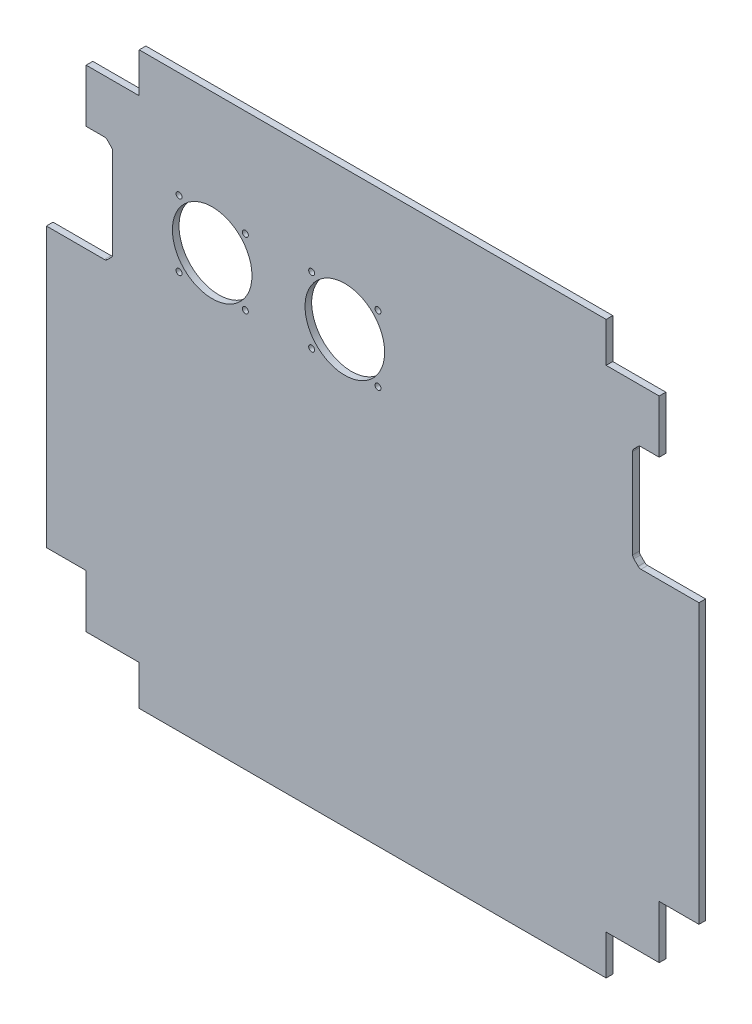
from build123d import *

# Parameters (mm, degrees)
SALIENTE_EXTRUIR1_DEPTH = 5
CROQUIS3_W              = 50
CROQUIS3_H              = 80
CORTAR_EXTRUIR2_DEPTH   = 10
CHAFL_N1_SIZE           = 5
REDONDEO1_R             = 3
CROQUIS4_R              = 2.25
CORTAR_EXTRUIR3_DEPTH   = 5
CROQUIS5_R              = 30
CORTAR_EXTRUIR4_DEPTH   = 327.750669471


with BuildPart() as part:
    # Croquis1 → Saliente-Extruir1 (new body)
    with BuildSketch(Plane.XY):
        Polygon((0, 215), (0, 0), (246, 0), (246, 145), (216, 145), (216, 185), (176, 185), (176, 215), align=None)
        Polygon((-246, 145), (-246, 0), (0, 0), (0, 215), (-176, 215), (-176, 185), (-216, 185), (-216, 145), align=None)
        Polygon((0, 0), (-246, 0), (-246, -145), (-216, -145), (-216, -185), (-176, -185), (-176, -215), (176, -215), (176, -185), (216, -185), (216, -145), (246, -145), (246, 0), align=None)
    extrude(amount=SALIENTE_EXTRUIR1_DEPTH)

    # Croquis3 → Cortar-Extruir2 (cut)
    with BuildSketch(Plane.XY.offset(5)):
        with Locations((-221, 105)):
            Rectangle(CROQUIS3_W, CROQUIS3_H)
        with Locations((221, 105)):
            Rectangle(CROQUIS3_W, CROQUIS3_H)
    extrude(amount=-CORTAR_EXTRUIR2_DEPTH, mode=Mode.SUBTRACT)

    # Chaflán1
    chafl_n1_edges = [part.edges().sort_by_distance(p)[0] for p in [
        (-196, 65, 2.5),
        (-196, 145, 2.5),
        (196, 65, 2.5),
        (196, 145, 2.5),
    ]]
    chamfer(chafl_n1_edges, length=CHAFL_N1_SIZE)

    # Redondeo1
    redondeo1_edges = [part.edges().sort_by_distance(p)[0] for p in [
        (-196, 140, 2.5),
        (-196, 70, 2.5),
        (-201, 65, 2.5),
        (-201, 145, 2.5),
        (201, 65, 2.5),
        (196, 140, 2.5),
        (196, 70, 2.5),
        (201, 145, 2.5),
    ]]
    fillet(redondeo1_edges, radius=REDONDEO1_R)

    # Croquis4 → Cortar-Extruir3 (cut, symmetric)
    with BuildSketch(Plane.XY.offset(5)):
        with Locations((-146, 135)):
            Circle(CROQUIS4_R)
        with Locations((-96, 135)):
            Circle(CROQUIS4_R)
        with Locations((-146, 85)):
            Circle(CROQUIS4_R)
        with Locations((-96, 85)):
            Circle(CROQUIS4_R)
        with Locations((-46, 135)):
            Circle(CROQUIS4_R)
        with Locations((-46, 85)):
            Circle(CROQUIS4_R)
        with Locations((4, 135)):
            Circle(CROQUIS4_R)
        with Locations((4, 85)):
            Circle(CROQUIS4_R)
    extrude(amount=CORTAR_EXTRUIR3_DEPTH, both=True, mode=Mode.SUBTRACT)

    # Croquis5 → Cortar-Extruir4 (cut, through all)
    with BuildSketch(Plane.XY.offset(5)):
        with Locations((-121, 110)):
            Circle(CROQUIS5_R)
        with Locations((-21, 110)):
            Circle(CROQUIS5_R)
    extrude(amount=-CORTAR_EXTRUIR4_DEPTH, mode=Mode.SUBTRACT)


solid = part.part
